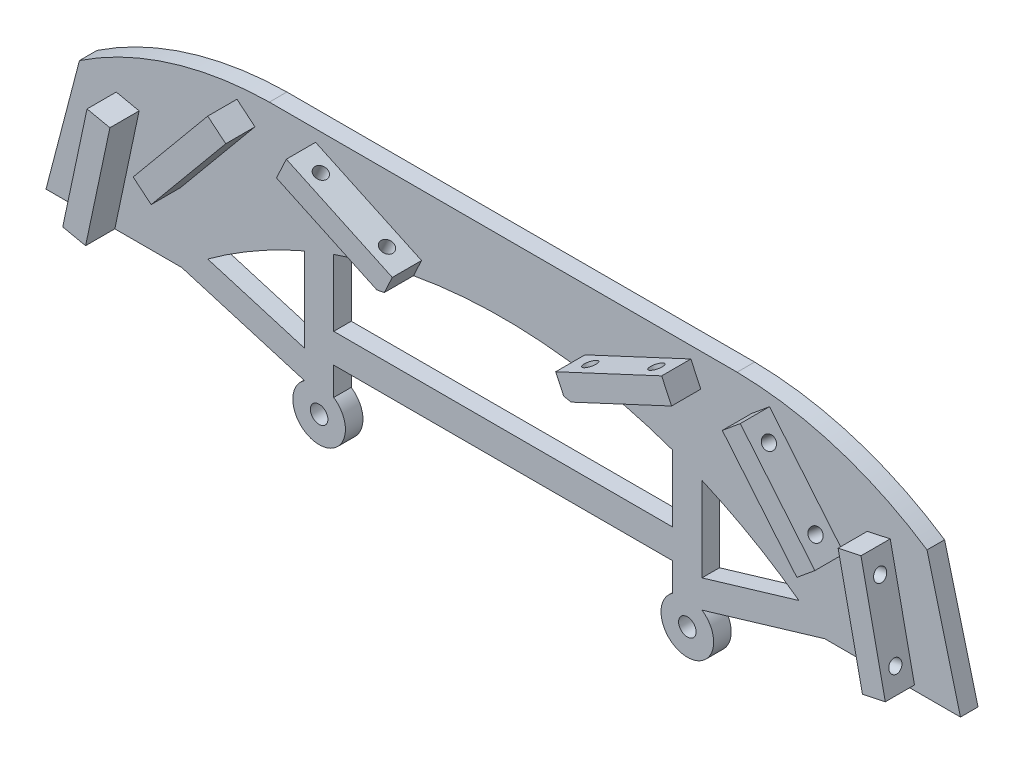
from build123d import *

# Parameters (mm, degrees)
DODANIE_WYCI_GNI_CIE1_DEPTH = 3
DODANIE_WYCI_GNI_CIE2_DEPTH = 5
SZKIC4_R                    = 1.1
WYTNIJ_WYCI_GNI_CIE1_DEPTH  = 5
SZKIC5_R                    = 1.1
WYTNIJ_WYCI_GNI_CIE2_DEPTH  = 5
WYTNIJ_WYCI_GNI_CIE4_DEPTH  = 3
WYTNIJ_WYCI_GNI_CIE5_DEPTH  = 5
SZKIC9_R                    = 1.5
DODANIE_WYCI_GNI_CIE3_DEPTH = 3
SZKIC10_R                   = 1.1
WYTNIJ_WYCI_GNI_CIE6_DEPTH  = 5
WYTNIJ_WYCI_GNI_CIE7_START  = -5
WYTNIJ_WYCI_GNI_CIE7_DEPTH  = 5
DODANIE_WYCI_GNI_CIE4_DEPTH = 3


with BuildPart() as part:
    # Szkic1 → Dodanie-wyciągnięcie1 (new body)
    with BuildSketch(Plane.XY):
        with BuildLine():
            Line((0, 0), (90, 0))
            ThreePointArc((90, 0), (69.043592277, 21.739320462), (40, 30))
            Line((40, 30), (-40, 30))
            ThreePointArc((-40, 30), (-69.043592277, 21.739320462), (-90, 0))
            Line((-90, 0), (0, 0))
        make_face()
    extrude(amount=DODANIE_WYCI_GNI_CIE1_DEPTH)

    # Szkic2 → Dodanie-wyciągnięcie2 (add)
    with BuildSketch(Plane.XY.offset(3)):
        Polygon((66.452138666, 0), (62.29390485, 19.562952015), (66.206495253, 20.394598778), (70.364729069, 0.831646763), align=None)
        Polygon((55.235819031, 11.703776172), (42.475467683, 27.104212317), (45.555554913, 29.656282587), (58.31590626, 14.255846441), align=None)
        Polygon((13.978557608, 21.547634765), (32.104713348, 30), (33.795186395, 26.374768852), (15.669030655, 17.922403617), align=None)
        Polygon((-15.669030655, 17.922403617), (-33.795186395, 26.374768852), (-32.104713348, 30), (-13.978557608, 21.547634765), align=None)
        Polygon((-58.31590626, 14.255846441), (-45.555554913, 29.656282587), (-42.475467683, 27.104212317), (-55.235819031, 11.703776172), align=None)
        Polygon((-66.452138666, 0), (-62.29390485, 19.562952015), (-66.206495253, 20.394598778), (-70.364729069, 0.831646763), align=None)
    extrude(amount=DODANIE_WYCI_GNI_CIE2_DEPTH)

    # Szkic4 → Wytnij-wyciągnięcie1 (cut)
    with BuildSketch(Plane(origin=(67.492184451, 14.345906666, 0), x_dir=(0, 0, -1), z_dir=(0.9781476007338049, 0.20791169081776306, 0))):
        with Locations(Location((-5.5, 2.433823491, 0), (0, 0, 90))):
            Circle(SZKIC4_R)
        with Locations(Location((-5.5, -10.066176509, 0), (0, 0, 90))):
            Circle(SZKIC4_R)
    extrude(amount=-WYTNIJ_WYCI_GNI_CIE1_DEPTH, mode=Mode.SUBTRACT)

    # Szkic5 → Wytnij-wyciągnięcie2 (cut)
    with BuildSketch(Plane(origin=(41.581177594, 34.452948638, 0), x_dir=(0, 0, -1), z_dir=(0.7700218072989731, 0.6380175673788483, 0))):
        with Locations(Location((-5.5, -9.979260011, 0), (0, 0, 90))):
            Circle(SZKIC5_R)
        with Locations(Location((-5.5, -22.479260011, 0), (0, 0, 90))):
            Circle(SZKIC5_R)
    extrude(amount=-WYTNIJ_WYCI_GNI_CIE2_DEPTH, mode=Mode.SUBTRACT)

    # Szkic7 → Wytnij-wyciągnięcie4 (cut)
    with BuildSketch(Plane.XY.offset(3)):
        Polygon((-78.226069333, 0), (-71.395700622, 20.250148823), (-90, 20.250148823), (-90, 0), align=None)
        Polygon((78.226069333, 0), (71.395700622, 20.250148823), (90, 20.250148823), (90, 0), align=None)
    extrude(amount=-WYTNIJ_WYCI_GNI_CIE4_DEPTH, mode=Mode.SUBTRACT)

    # Szkic8 → Wytnij-wyciągnięcie5 (cut)
    with BuildSketch(Plane.XY.offset(3)):
        with BuildLine():
            Line((-55, 0), (55, 0))
            ThreePointArc((55, 0), (0, 20), (-55, 0))
        make_face()
    extrude(amount=-WYTNIJ_WYCI_GNI_CIE5_DEPTH, mode=Mode.SUBTRACT)

    # Szkic9 → Dodanie-wyciągnięcie3 (add)
    with BuildSketch(Plane.XY.offset(3)):
        with BuildLine():
            Line((-34, -1.460002159), (-34, 16.899281574))
            Line((-34, 16.899281574), (-29, 16.899281574))
            Line((-29, 16.899281574), (-29, 3.542658996))
            Line((-29, 3.542658996), (29, 3.542658996))
            Line((29, 3.542658996), (29, 16.706714806))
            Line((29, 16.706714806), (34, 16.706714806))
            Line((34, 16.706714806), (34, -1.484644107))
            Line((34, -1.484644107), (55, 4.773698506))
            Line((55, 4.773698506), (55, 0))
            Line((55, 0), (34, -6.258342613))
            ThreePointArc((34, -6.258342613), (31.5, -14.5), (29, -6.258342613))
            Line((29, -6.258342613), (29, -1.457341004))
            Line((29, -1.457341004), (-29, -1.457341004))
            Line((-29, -1.457341004), (-29, -6.258342613))
            ThreePointArc((-29, -6.258342613), (-31.5, -14.5), (-34, -6.258342613))
            Line((-34, -6.258342613), (-55, 0))
            Line((-55, 0), (-55, 4.798340454))
            Line((-55, 4.798340454), (-34, -1.460002159))
        make_face()
        with Locations((-31.5, -10)):
            Circle(SZKIC9_R, mode=Mode.SUBTRACT)
        with Locations((31.5, -10)):
            Circle(SZKIC9_R, mode=Mode.SUBTRACT)
    extrude(amount=-DODANIE_WYCI_GNI_CIE3_DEPTH)

    # Szkic10 → Wytnij-wyciągnięcie6 (cut)
    with BuildSketch(Plane(origin=(-5.756565949, 12.344995516, 0), x_dir=(0.9063077870366489, 0.4226182617407018, 0), z_dir=(-0.4226182617407018, 0.9063077870366489, 0))):
        with Locations(Location((25.52529956, -5.5, 0), (0, 0, 180))):
            Circle(SZKIC10_R)
        with Locations(Location((38.02529956, -5.5, 0), (0, 0, 180))):
            Circle(SZKIC10_R)
    wytnij_wyci_gni_cie6 = extrude(amount=-WYTNIJ_WYCI_GNI_CIE6_DEPTH, mode=Mode.SUBTRACT)

    # Lustro3: Wytnij-wyciągnięcie6 across plane
    add(wytnij_wyci_gni_cie6.mirror(Plane(origin=(0, 0, 0), x_dir=(0, 0, 1), z_dir=(1, 0, 0))), mode=Mode.SUBTRACT)

    # Szkic11 → Wytnij-wyciągnięcie7 (cut)
    with BuildSketch(Plane(origin=(0, 0, 3), x_dir=(-1, 0, 0), z_dir=(0, 0, -1)).offset(WYTNIJ_WYCI_GNI_CIE7_START)):
        with BuildLine():
            Line((15.34678986, 18.613451232), (15.669030655, 17.922403617))
            Line((15.669030655, 17.922403617), (16.62854705, 18.36983346))
            ThreePointArc((16.62854705, 18.36983346), (15.988132474, 18.494083715), (15.34678986, 18.613451232))
        make_face()
    wytnij_wyci_gni_cie7 = extrude(amount=WYTNIJ_WYCI_GNI_CIE7_DEPTH, mode=Mode.SUBTRACT)

    # Lustro4: Wytnij-wyciągnięcie7 across plane
    add(wytnij_wyci_gni_cie7.mirror(Plane(origin=(0, 0, 0), x_dir=(0, 0, 1), z_dir=(1, 0, 0))), mode=Mode.SUBTRACT)

    # Szkic13 → Dodanie-wyciągnięcie4 (add)
    with BuildSketch(Plane(origin=(0, 0, 0), x_dir=(-1, 0, 0), z_dir=(0, 0, -1))):
        with BuildLine():
            Line((-78.226069333, 0), (-72.505791603, 21.913788812))
            ThreePointArc((-72.505791603, 21.913788812), (-56.989531301, 29.307893383), (-40.013675559, 32))
            Line((-40.013675559, 32), (40.013675559, 32))
            ThreePointArc((40.013675559, 32), (56.989531301, 29.307893383), (72.505791603, 21.913788812))
            Line((72.505791603, 21.913788812), (78.226069333, 0))
            Line((78.226069333, 0), (0, 30))
            Line((0, 30), (-78.226069333, 0))
        make_face()
    extrude(amount=-DODANIE_WYCI_GNI_CIE4_DEPTH)


solid = part.part
